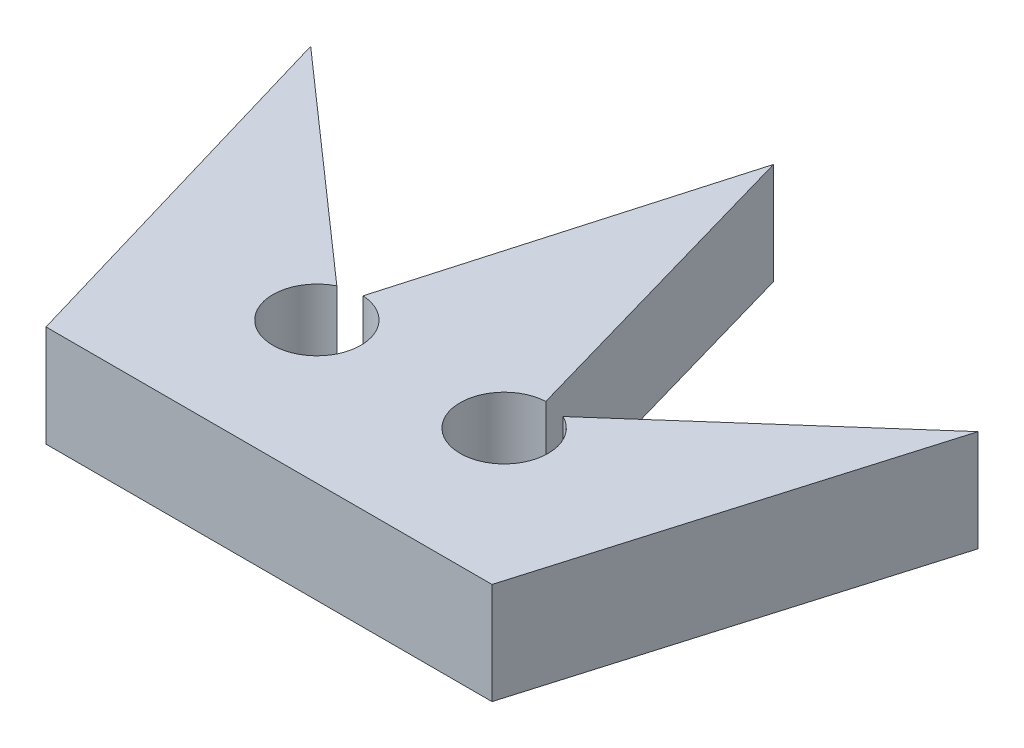
from build123d import *

# Parameters (mm, degrees)
BOSS_EXTRUDE1_DEPTH = 13.716
SCALE1_SCALE        = 1.5


with BuildPart() as part:
    # Sketch1 → Boss-Extrude1 (new body)
    with BuildSketch(Plane(origin=(0, 0, 0), x_dir=(1, 0, 0), z_dir=(0, 1, 0))):
        with BuildLine():
            Line((33.911483948, -31.607658541), (48.863023265, 19.10634644))
            Line((48.863023265, 19.10634644), (19.060968545, -7.15987128))
            ThreePointArc((19.060968545, -7.15987128), (15.22639693, -18.310469683), (16.13127503, -6.553727794))
            Line((16.13127503, -6.553727794), (3.778414078, 36.56159637))
            Line((3.778414078, 36.56159637), (-8.574446874, -6.553727794))
            ThreePointArc((-8.574446874, -6.553727794), (-7.669568774, -18.310469683), (-11.504140389, -7.15987128))
            Line((-11.504140389, -7.15987128), (-41.306195109, 19.10634644))
            Line((-41.306195109, 19.10634644), (-26.354655792, -31.607658541))
            Line((-26.354655792, -31.607658541), (33.911483948, -31.607658541))
        make_face()
    extrude(amount=BOSS_EXTRUDE1_DEPTH)


with BuildPart() as part_1:
    # Scale1: scaled about (3.778414078, 6.858, 9.196569952)
    add(part.part.scale(SCALE1_SCALE).moved(Location((-1.889207039, -3.429, -4.598284976))))


solid = part_1.part
